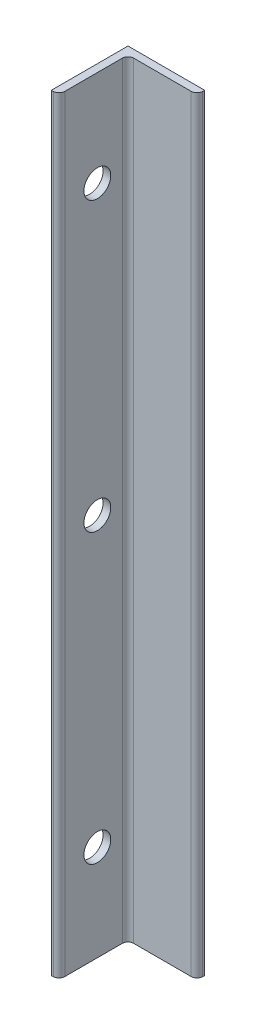
from build123d import *

# Parameters (mm, degrees)
BOSS_EXTRUDE1_DEPTH = 400
SKETCH2_R           = 7
CUT_EXTRUDE1_DEPTH  = 10


with BuildPart() as part:
    # Sketch1 → Boss-Extrude1 (new body)
    with BuildSketch(Plane(origin=(0, 0, 0), x_dir=(1, 0, 0), z_dir=(0, 1, 0))):
        with BuildLine():
            Line((-27.499872145, 29.213153277), (-67.499872145, 29.213153277))
            Line((-67.499872145, 29.213153277), (-67.499872145, -10.786846723))
            Line((-67.499872145, -10.786846723), (-66.499872145, -10.786846723))
            ThreePointArc((-66.499872145, -10.786846723), (-64.378551801, -9.908167067), (-63.499872145, -7.786846723))
            Line((-63.499872145, -7.786846723), (-63.499872145, 22.213153277))
            ThreePointArc((-63.499872145, 22.213153277), (-62.621192489, 24.334473621), (-60.499872145, 25.213153277))
            Line((-60.499872145, 25.213153277), (-30.499872145, 25.213153277))
            ThreePointArc((-30.499872145, 25.213153277), (-28.378551801, 26.091832933), (-27.499872145, 28.213153277))
            Line((-27.499872145, 28.213153277), (-27.499872145, 29.213153277))
        make_face()
    extrude(amount=BOSS_EXTRUDE1_DEPTH)

    # Sketch2 → Cut-Extrude1 (cut)
    with BuildSketch(Plane(origin=(-63.499872145, 0, 0), x_dir=(0, 0, -1), z_dir=(1, 0, 0))):
        with Locations((9.213153277, 200)):
            Circle(SKETCH2_R)
        with Locations((9.213153277, 50)):
            Circle(SKETCH2_R)
        with Locations((9.213153277, 350)):
            Circle(SKETCH2_R)
    extrude(amount=-CUT_EXTRUDE1_DEPTH, mode=Mode.SUBTRACT)


solid = part.part
